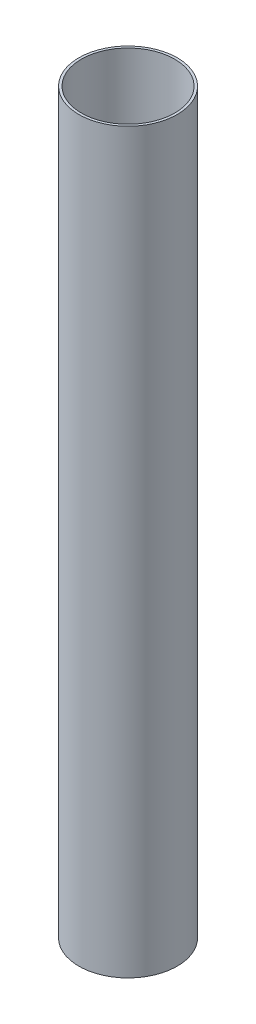
from build123d import *

# Parameters (mm, degrees)
SKETCH1_R           = 20.32
SKETCH1_R_2         = 19.304
BOSS_EXTRUDE1_DEPTH = 152.4


with BuildPart() as part:
    # Sketch1 → Boss-Extrude1 (new, symmetric)
    with BuildSketch(Plane(origin=(0, 0, 0), x_dir=(1, 0, 0), z_dir=(0, 1, 0))):
        with Locations(Location((0, 0, 0), (0, 0, 90))):
            Circle(SKETCH1_R)
        with Locations(Location((0, 0, 0), (0, 0, 90))):
            Circle(SKETCH1_R_2, mode=Mode.SUBTRACT)
    extrude(amount=BOSS_EXTRUDE1_DEPTH, both=True)


solid = part.part
